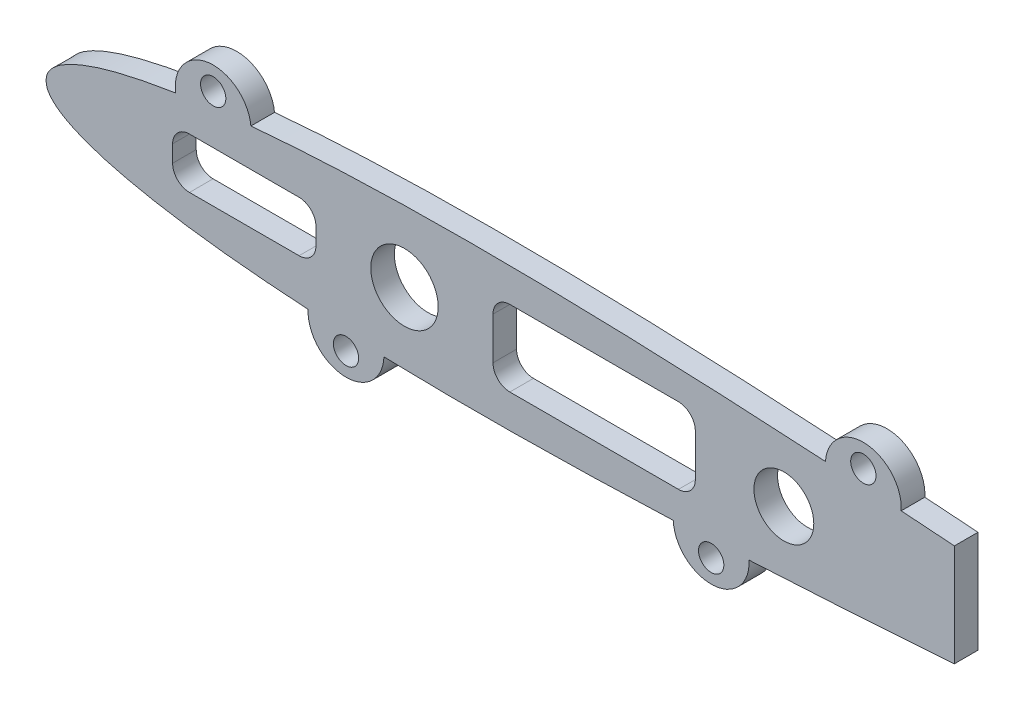
from build123d import *

# Parameters (mm, degrees)
SKETCH_1_R      = 1.5
SKETCH_1_R_2    = 4
SKETCH_1_R_3    = 3.55
EXTRUDE_1_DEPTH = 1.4


with BuildPart() as part:
    # Эскиз1 → Бобышка-Вытянуть1 (new, symmetric)
    with BuildSketch(Plane.XY):
        with BuildLine():
            Line((217.747634119, 0), (217.747634119, 6.058113078))
            add(Edge.make_bspline(
                [(217.747634119, 6.058113078), (217.243808474, 6.094887376), (215.140700226, 6.247183834), (213.037224342, 6.394367799), (211.437469318, 6.503148402)],
                knots=[0.362605011, 0.362605011, 0.362605011, 0.362605011, 0.371392651, 0.399285533, 0.399285533, 0.399285533, 0.399285533], degree=3))
            ThreePointArc((211.437469318, 6.503148402), (207.235292618, 11.29077317), (202.455940343, 7.079190122))
            add(Edge.make_bspline(
                [(202.455940343, 7.079190122), (202.056002141, 7.103223291), (200.009450225, 7.225045801), (196.331634567, 7.433105337), (191.441311474, 7.684604439), (186.608700127, 7.906218293), (181.844626933, 8.095958493), (177.159453511, 8.251957682), (172.563150272, 8.372486564), (168.065295924, 8.455953662), (163.675147454, 8.5010027), (159.401643404, 8.506522967), (155.253439756, 8.471528808), (151.238917925, 8.395506076), (147.366223919, 8.277985977), (143.643266298, 8.118975561), (140.077743555, 7.918678943), (136.982380939, 7.699243614), (135.077259612, 7.537606821), (134.305602735, 7.467259257)],
                knots=[0.451472212, 0.451472212, 0.451472212, 0.451472212, 0.458441906, 0.487136113, 0.515551917, 0.543623846, 0.571289984, 0.59849081, 0.625169613, 0.651272029, 0.676746158, 0.701541791, 0.725611017, 0.748907835, 0.771387785, 0.793008139, 0.813728033, 0.833507815, 0.846986731, 0.846986731, 0.846986731, 0.846986731], degree=3))
            ThreePointArc((134.305602735, 7.467259257), (129.292776458, 11.467825954), (125.371042184, 6.393088379))
            add(Edge.make_bspline(
                [(125.371042184, 6.393088379), (125.182557358, 6.363796993), (124.168294515, 6.203402144), (122.397158974, 5.896120566), (120.133109351, 5.434797476), (118.081312133, 4.94256764), (116.247665798, 4.421392386), (114.63793972, 3.873060465), (113.256788366, 3.299309237), (112.109835924, 2.701306387), (111.196336341, 2.078555233), (110.530223642, 1.427069758), (110.085538218, 0.73423022), (110.027578176, 0.23672144), (110, 0)],
                knots=[0.899174702, 0.899174702, 0.899174702, 0.899174702, 0.902492782, 0.917037139, 0.930441054, 0.942679762, 0.953733567, 0.963589785, 0.972247019, 0.979722225, 0.986065145, 0.991385258, 0.995900989, 1, 1, 1, 1], degree=3))
            add(Edge.make_bspline(
                [(110, 0), (110.027578176, -0.236721441), (110.085538218, -0.734230221), (110.530223642, -1.427069759), (111.196336341, -2.078555234), (112.109835924, -2.701306388), (113.256788366, -3.299309238), (114.63793972, -3.873060466), (116.247665798, -4.421392387), (118.081312133, -4.942567641), (120.133109351, -5.434797477), (122.397158974, -5.896120567), (124.867245825, -6.324666078), (127.536961089, -6.718650341), (130.399721686, -7.076424311), (133.448762895, -7.396480569), (136.677139412, -7.677604542), (139.245643336, -7.859689995), (140.736851964, -7.951317752), (141.093175889, -7.972438296)],
                knots=[0, 0, 0, 0, 0.004099011, 0.008614742, 0.013934855, 0.020277775, 0.027752981, 0.036410215, 0.046266433, 0.057320238, 0.069558946, 0.082962861, 0.097507218, 0.113164082, 0.12990269, 0.147690304, 0.166492185, 0.186271967, 0.192481252, 0.192481252, 0.192481252, 0.192481252], degree=3))
            ThreePointArc((141.093175889, -7.972438296), (145.394805922, -12.695875937), (150.084655985, -8.35765159))
            add(Edge.make_bspline(
                [(150.084655985, -8.35765159), (150.453806444, -8.367988388), (152.161758649, -8.412981849), (155.253439756, -8.471528808), (159.401643404, -8.506522967), (163.675147454, -8.5010027), (168.065295924, -8.455953663), (172.563150272, -8.372486564), (177.159453511, -8.251957682), (181.117095872, -8.120182624), (183.541473355, -8.027281081), (184.403269889, -7.992794251)],
                knots=[0.244668107, 0.244668107, 0.244668107, 0.244668107, 0.251092165, 0.274388983, 0.298458209, 0.323253842, 0.348727971, 0.374830387, 0.40150919, 0.428710016, 0.443713425, 0.443713425, 0.443713425, 0.443713425], degree=3))
            ThreePointArc((184.403269889, -7.992794251), (189.104065456, -12.29533144), (193.393900024, -7.582940899))
            add(Edge.make_bspline(
                [(193.393900024, -7.582940899), (194.367821921, -7.533422186), (196.98891626, -7.395921928), (201.268368917, -7.153826886), (206.239642946, -6.848873), (211.232977593, -6.52047435), (215.071311266, -6.252208631), (217.243808474, -6.094887376), (217.747634119, -6.058113078)],
                knots=[0.495900102, 0.495900102, 0.495900102, 0.495900102, 0.512863887, 0.541558094, 0.570462313, 0.599504248, 0.628607349, 0.637394989, 0.637394989, 0.637394989, 0.637394989], degree=3))
            Line((217.747634119, -6.058113078), (217.747634119, 0))
        make_face()
        with Locations((145.587418391, -10)):
            Circle(SKETCH_1_R, mode=Mode.SUBTRACT)
        with Locations((188.899138034, -9.6)):
            Circle(SKETCH_1_R, mode=Mode.SUBTRACT)
        with BuildLine():
            Line((140.01848428, -3), (127.01848428, -3))
            ThreePointArc((127.01848428, -3), (125.604270718, -2.414213562), (125.01848428, -1))
            Line((125.01848428, -1), (125.01848428, 1))
            ThreePointArc((125.01848428, 1), (125.604270718, 2.414213562), (127.01848428, 3))
            Line((127.01848428, 3), (140.01848428, 3))
            ThreePointArc((140.01848428, 3), (141.432697843, 2.414213562), (142.01848428, 1))
            Line((142.01848428, 1), (142.01848428, -1))
            ThreePointArc((142.01848428, -1), (141.432697843, -2.414213562), (140.01848428, -3))
        make_face(mode=Mode.SUBTRACT)
        with Locations((152.51848428, 0)):
            Circle(SKETCH_1_R_2, mode=Mode.SUBTRACT)
        with BuildLine():
            Line((185.01848428, -4.5), (165.01848428, -4.5))
            ThreePointArc((165.01848428, -4.5), (163.604270718, -3.914213562), (163.01848428, -2.5))
            Line((163.01848428, -2.5), (163.01848428, 2.5))
            ThreePointArc((163.01848428, 2.5), (163.604270718, 3.914213562), (165.01848428, 4.5))
            Line((165.01848428, 4.5), (185.01848428, 4.5))
            ThreePointArc((185.01848428, 4.5), (186.432697843, 3.914213562), (187.01848428, 2.5))
            Line((187.01848428, 2.5), (187.01848428, -2.5))
            ThreePointArc((187.01848428, -2.5), (186.432697843, -3.914213562), (185.01848428, -4.5))
        make_face(mode=Mode.SUBTRACT)
        with Locations((129.829927502, 8.8)):
            Circle(SKETCH_1_R, mode=Mode.SUBTRACT)
        with Locations((197.51848428, 0)):
            Circle(SKETCH_1_R_3, mode=Mode.SUBTRACT)
        with Locations((206.947271201, 8.6)):
            Circle(SKETCH_1_R, mode=Mode.SUBTRACT)
    extrude(amount=EXTRUDE_1_DEPTH, both=True)


solid = part.part
